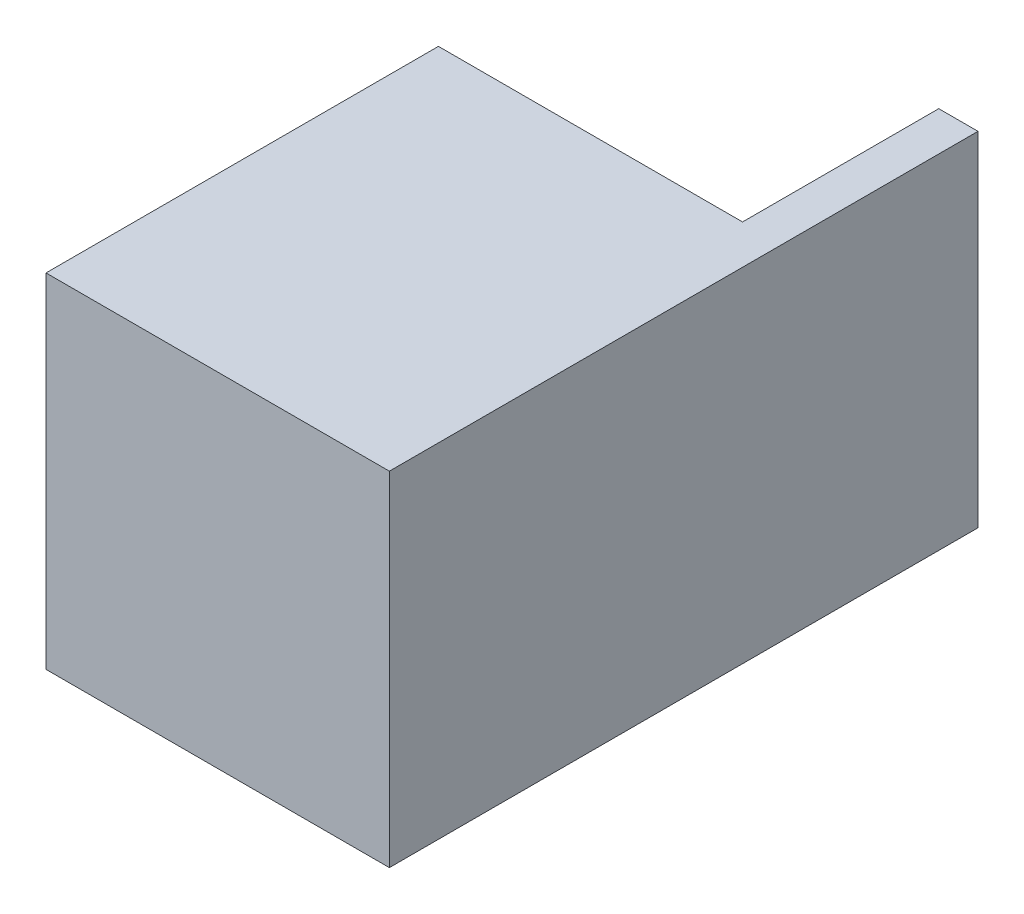
from build123d import *

# Parameters (mm, degrees)
CROQUIS1_W              = 35
CROQUIS1_H              = 35
SALIENTE_EXTRUIR1_DEPTH = 40
SALIENTE_EXTRUIR3_DEPTH = 20


with BuildPart() as part:
    # Croquis1 → Saliente-Extruir1 (new body)
    with BuildSketch(Plane.XY):
        Rectangle(CROQUIS1_W, CROQUIS1_H)
    extrude(amount=SALIENTE_EXTRUIR1_DEPTH)

    # Croquis4 → Saliente-Extruir3 (add)
    with BuildSketch(Plane(origin=(0, 0, 0), x_dir=(-1, 0, 0), z_dir=(0, 0, -1))):
        Polygon((-13.5, 13.5), (-13.5, 17.5), (-17.5, 17.5), (-17.5, -17.5), (17.5, -17.5), (17.5, -13.5), (13.5, -13.5), (-13.5, -13.5), align=None)
    extrude(amount=SALIENTE_EXTRUIR3_DEPTH)


solid = part.part
